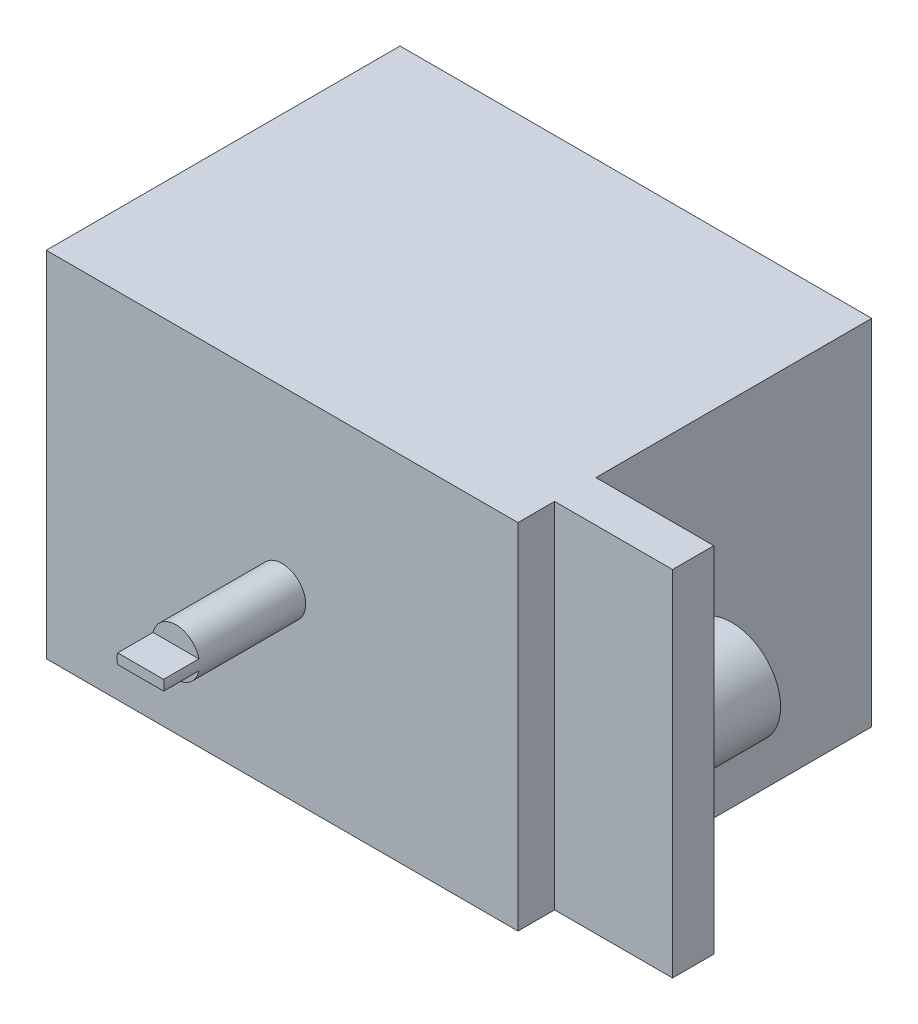
from build123d import *

# Parameters (mm, degrees)
SKETCH1_W           = 200
SKETCH1_H           = 150
BOSS_EXTRUDE1_DEPTH = 150
SKETCH2_R           = 14.834241456
CUT_EXTRUDE1_DEPTH  = 5
LPATTERN1_COUNT     = 3
LPATTERN1_PITCH     = 50
SKETCH3_W           = 17.49362466
SKETCH3_H           = 150
BOSS_EXTRUDE2_DEPTH = 50
SKETCH4_R           = 20.657727603
BOSS_EXTRUDE3_DEPTH = 30
SKETCH5_R           = 10
BOSS_EXTRUDE4_DEPTH = 60
SKETCH6_W           = 19.92759369
SKETCH6_H           = 8.419652836
SKETCH6_W_2         = 21.376212584
SKETCH6_H_2         = 8.0068992
CUT_EXTRUDE2_DEPTH  = 15


with BuildPart() as part:
    # Sketch1 → Boss-Extrude1 (new body)
    with BuildSketch(Plane.XY):
        Rectangle(SKETCH1_W, SKETCH1_H)
    extrude(amount=BOSS_EXTRUDE1_DEPTH)

    # Sketch2 → Cut-Extrude1 (cut)
    with BuildSketch(Plane(origin=(0, 0, 0), x_dir=(-1, 0, 0), z_dir=(0, 0, -1))):
        with Locations((80.018238541, 54.109118562)):
            Circle(SKETCH2_R)
    cut_extrude1 = extrude(amount=-CUT_EXTRUDE1_DEPTH, mode=Mode.SUBTRACT)

    # LPattern1: Cut-Extrude1 ×3
    with Locations(*[(0, -i * LPATTERN1_PITCH, 0) for i in range(1, LPATTERN1_COUNT)]):
        add(cut_extrude1, mode=Mode.SUBTRACT)

    # Sketch3 → Boss-Extrude2 (add)
    with BuildSketch(Plane(origin=(100, 0, 0), x_dir=(0, 0, -1), z_dir=(1, 0, 0))):
        with Locations((-125.713599326, 0)):
            Rectangle(SKETCH3_W, SKETCH3_H)
    extrude(amount=BOSS_EXTRUDE2_DEPTH)

    # Sketch4 → Boss-Extrude3 (add)
    with BuildSketch(Plane(origin=(0, 0, 116.966786996), x_dir=(-1, 0, 0), z_dir=(0, 0, -1))):
        with Locations(Location((-127.668059081, 0, 0), (0, 0, 180))):
            Circle(SKETCH4_R)
    extrude(amount=BOSS_EXTRUDE3_DEPTH)

    # Sketch5 → Boss-Extrude4 (add)
    with BuildSketch(Plane.XY.offset(150)):
        with Locations(Location((0, 0, 0), (0, 0, 180))):
            Circle(SKETCH5_R)
    extrude(amount=BOSS_EXTRUDE4_DEPTH)

    # Sketch6 → Cut-Extrude2 (cut)
    with BuildSketch(Plane.XY.offset(210)):
        with Locations((0.233720093, 6.517553958)):
            Rectangle(SKETCH6_W, SKETCH6_H)
        with Locations((-0.888741557, -5.9965504)):
            Rectangle(SKETCH6_W_2, SKETCH6_H_2)
    extrude(amount=-CUT_EXTRUDE2_DEPTH, mode=Mode.SUBTRACT)


solid = part.part
